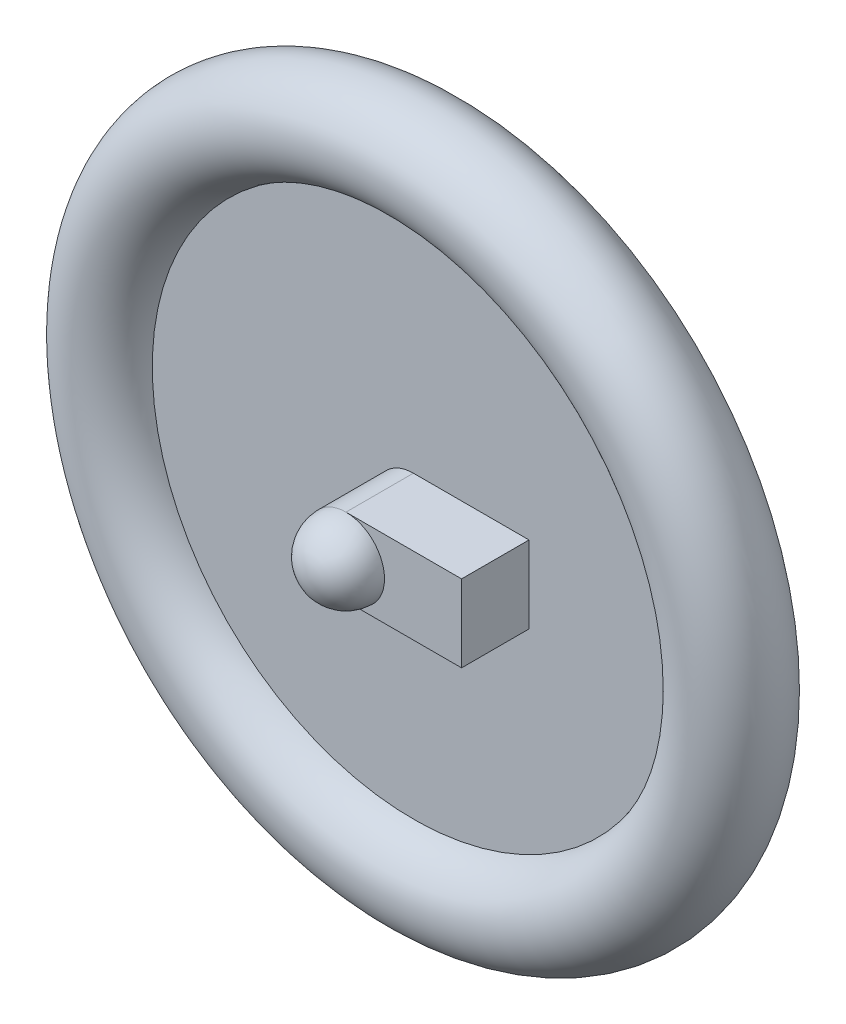
from build123d import *

# Parameters (mm, degrees)
SKETCH1_R                       = 12.5
BOSS_EXTRUDE1_REACH             = 133.411
SKETCH2_W                       = 160
SKETCH2_H                       = 5
BOSS_EXTRUDE1_DIRECTION_2_REACH = 133.411
SKETCH6_W                       = 17.5
SKETCH6_H                       = 20
BOSS_EXTRUDE2_DEPTH             = 30


with BuildPart() as part:
    # Sketch1 → Revolve1 (revolve)
    with BuildSketch(Plane(origin=(0, 0, 0), x_dir=(1, 0, 0), z_dir=(0, 1, 0))):
        with Locations((80, 0)):
            Circle(SKETCH1_R)
    revolve(axis=Axis((0, 0, 0), (0, 0, -1)))

    # Sketch2 → Boss-Extrude1 (add, up to next)
    with BuildSketch(Plane(origin=(0, 0, 0), x_dir=(1, 0, 0), z_dir=(0, 1, 0)), mode=Mode.PRIVATE) as boss_extrude1_sk1:
        Rectangle(SKETCH2_W, SKETCH2_H)
    boss_extrude1_tool1 = extrude(boss_extrude1_sk1.sketch, amount=BOSS_EXTRUDE1_REACH, mode=Mode.PRIVATE) - part.part
    add(boss_extrude1_tool1.solids().sort_by_distance((0, 0, 0))[0])

    # Sketch2 → Boss-Extrude1 direction 2 (add, up to next)
    with BuildSketch(Plane(origin=(0, 0, 0), x_dir=(1, 0, 0), z_dir=(0, 1, 0)), mode=Mode.PRIVATE) as boss_extrude1_direction_2_sk1:
        Rectangle(SKETCH2_W, SKETCH2_H)
    boss_extrude1_direction_2_tool1 = extrude(boss_extrude1_direction_2_sk1.sketch, amount=-BOSS_EXTRUDE1_DIRECTION_2_REACH, mode=Mode.PRIVATE) - part.part
    add(boss_extrude1_direction_2_tool1.solids().sort_by_distance((0, 0, 0))[0])

    # Sketch4 → Revolve2 (revolve)
    with BuildSketch(Plane(origin=(0, 0, 0), x_dir=(1, 0, 0), z_dir=(0, 1, 0))):
        with BuildLine():
            Line((0, -30), (0, 0))
            Line((0, 0), (10, 0))
            Line((10, 0), (10, -20))
            ThreePointArc((10, -20), (7.071067812, -27.071067812), (0, -30))
        make_face()
    revolve(axis=Axis((0, 0, 30), (0, 0, -1)))

    # Sketch6 → Boss-Extrude2 (add)
    with BuildSketch(Plane(origin=(0, 0, 0), x_dir=(0, 0, -1), z_dir=(1, 0, 0))):
        with Locations((-11.25, 0)):
            Rectangle(SKETCH6_W, SKETCH6_H)
    extrude(amount=BOSS_EXTRUDE2_DEPTH)


solid = part.part
